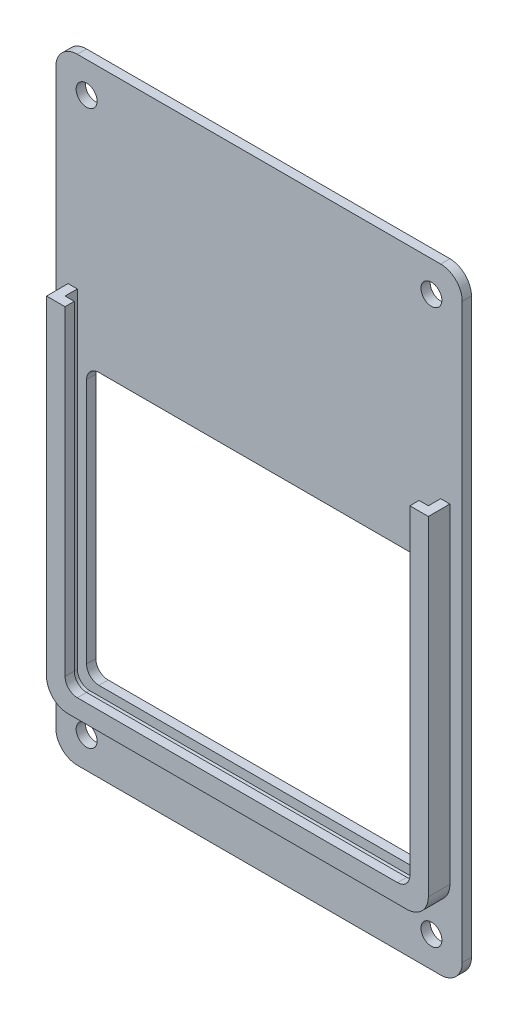
from build123d import *

# Parameters (mm, degrees)
SKETCH_1_W          = 66
SKETCH_1_H          = 100
EXTRUDE_1_DEPTH     = 1.5
FILLET_1_R          = 3.5
SKETCH_2_W          = 56
SKETCH_2_H          = 44
CUT_EXTRUDE_1_DEPTH = 1.5
FILLET_2_R          = 2
EXTRUDE_2_DEPTH     = 2
FILLET_3_R          = 2
EXTRUDE_START       = 1.5
EXTRUDE_3_DEPTH     = 1.5
FILLET_4_R          = 2
FILLET_5_R          = 3.5
SKETCH_5_W          = 48
SKETCH_5_H          = 10
EXTRUDE_4_DEPTH     = 1.5
FILLET_6_R          = 2
HOLE_WIZARD_M31_D   = 3.4
CUT_EXTRUDE_2_DEPTH = 1.5
CUT_EXTRUDE_3_DEPTH = 1.5


with BuildPart() as part:
    # Эскиз1 → Бобышка-Вытянуть1 (new body)
    with BuildSketch(Plane.XY):
        Rectangle(SKETCH_1_W, SKETCH_1_H)
    extrude(amount=EXTRUDE_1_DEPTH)

    # Скругление1
    fillet_1_edges = [part.edges().sort_by_distance(p)[0] for p in [
        (-33, -50, 0.75),
        (-33, 50, 0.75),
        (33, 50, 0.75),
        (33, -50, 0.75),
    ]]
    fillet(fillet_1_edges, radius=FILLET_1_R)

    # Эскиз2 → Вырез-Вытянуть1 (cut)
    with BuildSketch(Plane.XY.offset(1.5)):
        with Locations((0, -15)):
            Rectangle(SKETCH_2_W, SKETCH_2_H)
    extrude(amount=-CUT_EXTRUDE_1_DEPTH, mode=Mode.SUBTRACT)

    # Скругление2
    fillet_2_edges = [part.edges().sort_by_distance(p)[0] for p in [
        (28, 7, 0.75),
        (28, -37, 0.75),
        (-28, -37, 0.75),
        (-28, 7, 0.75),
    ]]
    fillet(fillet_2_edges, radius=FILLET_2_R)

    # Эскиз3 → Бобышка-Вытянуть2 (add)
    with BuildSketch(Plane.XY.offset(1.5)):
        Polygon((29.5, -38.5), (-29.5, -38.5), (-29.5, 17), (-31, 17), (-31, -40), (31, -40), (31, 17), (29.5, 17), align=None)
    extrude(amount=EXTRUDE_2_DEPTH)

    # Скругление3
    fillet_3_edges = [part.edges().sort_by_distance(p)[0] for p in [
        (29.5, -38.5, 2.5),
        (-29.5, -38.5, 2.5),
    ]]
    fillet(fillet_3_edges, radius=FILLET_3_R)

    # Эскиз4 → Бобышка-Вытянуть3 (add)
    with BuildSketch(Plane.XY.offset(3.5).offset(EXTRUDE_START)):
        with BuildLine():
            Line((-31, -40), (31, -40))
            Line((31, -40), (31, 17))
            Line((31, 17), (29.5, 17))
            Line((29.5, 17), (29.5, -36.5))
            ThreePointArc((29.5, -36.5), (28.914213562, -37.914213562), (27.5, -38.5))
            Line((27.5, -38.5), (-27.5, -38.5))
            ThreePointArc((-27.5, -38.5), (-28.914213562, -37.914213562), (-29.5, -36.5))
            Line((-29.5, -36.5), (-29.5, 17))
            Line((-29.5, 17), (-31, 17))
            Line((-31, 17), (-31, -40))
        make_face()
        with BuildLine():
            Line((-28, 17), (-29.5, 17))
            Line((-29.5, 17), (-29.5, -36.5))
            ThreePointArc((-29.5, -36.5), (-28.914213562, -37.914213562), (-27.5, -38.5))
            Line((-27.5, -38.5), (27.5, -38.5))
            ThreePointArc((27.5, -38.5), (28.914213562, -37.914213562), (29.5, -36.5))
            Line((29.5, -36.5), (29.5, 17))
            Line((29.5, 17), (28, 17))
            Line((28, 17), (28, -37))
            Line((28, -37), (-28, -37))
            Line((-28, -37), (-28, 17))
        make_face()
    extrude(amount=-EXTRUDE_3_DEPTH)

    # Скругление4
    fillet_4_edges = [part.edges().sort_by_distance(p)[0] for p in [
        (28, -37, 4.25),
        (-28, -37, 4.25),
    ]]
    fillet(fillet_4_edges, radius=FILLET_4_R)

    # Скругление5
    fillet_5_edges = [part.edges().sort_by_distance(p)[0] for p in [
        (31, -40, 3.25),
        (-31, -40, 3.25),
    ]]
    fillet(fillet_5_edges, radius=FILLET_5_R)

    # Эскиз5 → Бобышка-Вытянуть4 (add)
    with BuildSketch(Plane(origin=(0, 0, 0), x_dir=(-1, 0, 0), z_dir=(0, 0, -1))):
        Polygon((24, 48.5), (-24, 48.5), (-24, 41), (-31.5, 41), (-31.5, 8), (31.5, 8), (31.5, 41), (24, 41), align=None)
        with Locations((0, -43.5)):
            Rectangle(SKETCH_5_W, SKETCH_5_H)
    extrude(amount=EXTRUDE_4_DEPTH)

    # Скругление6
    fillet_6_edges = [part.edges().sort_by_distance(p)[0] for p in [
        (-24, 48.5, -0.75),
        (24, 48.5, -0.75),
        (24, 41, -0.75),
        (31.5, 41, -0.75),
        (31.5, 8, -0.75),
        (-31.5, 8, -0.75),
        (-31.5, 41, -0.75),
        (-24, 41, -0.75),
        (-24, -48.5, -0.75),
        (-24, -38.5, -0.75),
        (24, -38.5, -0.75),
        (24, -48.5, -0.75),
    ]]
    fillet(fillet_6_edges, radius=FILLET_6_R)

    # Отверстие с зазором M31 (through all)
    with Locations(Plane.XY.offset(1.5)):
        with Locations((-28, 45), (28, 45), (28, -45), (-28, -45)):
            Hole(HOLE_WIZARD_M31_D / 2)

    # Sketch 1 2 → Вырез-Вытянуть2 (cut)
    with BuildSketch(Plane(origin=(-22.5, 43, -1.5), x_dir=(0.969195618248602, -0.24629221174797694, 0), z_dir=(0, 0, -1))):
        with BuildLine():
            Line((0, 0), (-0.862022741, -3.392184664))
            add(Edge.make_bspline(
                [(-0.862022741, -3.392184664), (-0.863457613, -3.397831093), (-0.864892485, -3.403477523), (-0.866283544, -3.409134242), (-0.870193841, -3.426166131), (-0.872921182, -3.443475822), (-0.87429772, -3.455099278), (-0.876845006, -3.484267559), (-0.877682577, -3.513461156), (-0.877506842, -3.530961817), (-0.875673257, -3.565882924), (-0.870624324, -3.600545153), (-0.867321375, -3.617762152), (-0.859209221, -3.651869127), (-0.848185975, -3.685124473), (-0.841958, -3.701499226), (-0.828092189, -3.733662861), (-0.811452342, -3.764494704), (-0.802462818, -3.779537639), (-0.783192383, -3.808797464), (-0.76143481, -3.836245043), (-0.749964121, -3.84948679), (-0.725898702, -3.874948234), (-0.699704731, -3.898249651), (-0.686106911, -3.909314514), (-0.65808457, -3.930097534), (-0.628323297, -3.948192056), (-0.613121943, -3.95657929), (-0.587278851, -3.969569135), (-0.560664248, -3.981070005), (-0.54991601, -3.985331953), (-0.533659435, -3.991075379), (-0.517093145, -3.995685826), (-0.511593299, -3.997127599), (-0.506082169, -3.998528089), (-0.500571038, -3.999928579)],
                knots=[0, 0, 0, 0, 0, 0, 0.037135921, 0.037135921, 0.037135921, 0.111407738, 0.111407738, 0.111407738, 0.222815464, 0.222815464, 0.222815464, 0.334223191, 0.334223191, 0.334223191, 0.445630917, 0.445630917, 0.445630917, 0.557038643, 0.557038643, 0.557038643, 0.668446369, 0.668446369, 0.668446369, 0.779854095, 0.779854095, 0.779854095, 0.890371976, 0.890371976, 0.890371976, 0.963753949, 0.963753949, 0.963753949, 1, 1, 1, 1, 1, 1], degree=5))
            Line((-0.500571038, -3.999928579), (42.144036165, -14.836785896))
            add(Edge.make_bspline(
                [(42.144036165, -14.836785896), (42.149682595, -14.838220768), (42.155329024, -14.83965564), (42.160985743, -14.841046699), (42.178017632, -14.844956996), (42.195327323, -14.847684337), (42.206950779, -14.849060874), (42.23611906, -14.851608161), (42.265312657, -14.852445732), (42.282813319, -14.852269997), (42.317734425, -14.850436412), (42.352396654, -14.845387479), (42.369613653, -14.84208453), (42.403720629, -14.833972376), (42.436975975, -14.822949129), (42.453350727, -14.816721154), (42.485514362, -14.802855343), (42.516346205, -14.786215497), (42.53138914, -14.777225972), (42.560648965, -14.757955538), (42.588096545, -14.736197965), (42.601338291, -14.724727276), (42.626799735, -14.700661857), (42.650101153, -14.674467885), (42.661166015, -14.660870065), (42.681949035, -14.632847725), (42.700043558, -14.603086451), (42.708430792, -14.587885098), (42.721420637, -14.562042006), (42.732921506, -14.535427403), (42.737183454, -14.524679164), (42.742926881, -14.50842259), (42.747537327, -14.491856299), (42.7489791, -14.486356454), (42.75037959, -14.480845323), (42.75178008, -14.475334193)],
                knots=[0, 0, 0, 0, 0, 0, 0.037135921, 0.037135921, 0.037135921, 0.111407738, 0.111407738, 0.111407738, 0.222815464, 0.222815464, 0.222815464, 0.334223191, 0.334223191, 0.334223191, 0.445630917, 0.445630917, 0.445630917, 0.557038643, 0.557038643, 0.557038643, 0.668446369, 0.668446369, 0.668446369, 0.779854095, 0.779854095, 0.779854095, 0.890371976, 0.890371976, 0.890371976, 0.963753949, 0.963753949, 0.963753949, 1, 1, 1, 1, 1, 1], degree=5))
            Line((42.75178008, -14.475334193), (43.613802821, -11.083149529))
            add(Edge.make_bspline(
                [(43.613802821, -11.083149529), (43.623846925, -11.043624522), (43.633891029, -11.004099514), (43.644239002, -10.964657641), (43.677106133, -10.846830819), (43.718177724, -10.731248595), (43.748555104, -10.655155268), (43.830364086, -10.467235402), (43.922773731, -10.284873474), (43.982339652, -10.177818354), (44.110319556, -9.969154549), (44.257211167, -9.772828329), (44.335063874, -9.677968706), (44.498941039, -9.495294617), (44.677877604, -9.327587204), (44.770906765, -9.247683112), (44.963678906, -9.096190047), (45.169062799, -8.962159001), (45.274626829, -8.899675347), (45.490937351, -8.784104506), (45.716489377, -8.687992056), (45.831295114, -8.644878827), (46.064404733, -8.568695156), (46.303388035, -8.512910654), (46.424002373, -8.490295529), (46.665815372, -8.456111266), (46.909339508, -8.444274609), (47.030868499, -8.443487745), (47.233233643, -8.449954674), (47.435368198, -8.468158228), (47.515720951, -8.47786327), (47.634905086, -8.496864254), (47.75220793, -8.523868962), (47.790854396, -8.533380749), (47.829432311, -8.543184177), (47.868010226, -8.552987606)],
                knots=[0, 0, 0, 0, 0, 0, 0.037135909, 0.037135909, 0.037135909, 0.111407726, 0.111407726, 0.111407726, 0.222815452, 0.222815452, 0.222815452, 0.334223178, 0.334223178, 0.334223178, 0.445630904, 0.445630904, 0.445630904, 0.55703863, 0.55703863, 0.55703863, 0.668446357, 0.668446357, 0.668446357, 0.779854083, 0.779854083, 0.779854083, 0.890371964, 0.890371964, 0.890371964, 0.963753936, 0.963753936, 0.963753936, 1, 1, 1, 1, 1, 1], degree=5))
            Line((47.868010226, -8.552987606), (51.26019489, -9.415010347))
            add(Edge.make_bspline(
                [(51.26019489, -9.415010347), (51.26584132, -9.416445219), (51.271487749, -9.417880091), (51.277144468, -9.41927115), (51.294176357, -9.423181447), (51.311486048, -9.425908788), (51.323109504, -9.427285325), (51.352277785, -9.429832612), (51.381471382, -9.430670183), (51.398972044, -9.430494448), (51.43389315, -9.428660863), (51.468555379, -9.42361193), (51.485772378, -9.420308981), (51.519879354, -9.412196827), (51.5531347, -9.401173581), (51.569509452, -9.394945606), (51.601673087, -9.381079795), (51.63250493, -9.364439948), (51.647547865, -9.355450423), (51.67680769, -9.336179989), (51.704255269, -9.314422416), (51.717497016, -9.302951727), (51.74295846, -9.278886308), (51.766259878, -9.252692337), (51.77732474, -9.239094517), (51.79810776, -9.211072176), (51.816202283, -9.181310903), (51.824589517, -9.166109549), (51.837579362, -9.140266457), (51.849080231, -9.113651854), (51.853342179, -9.102903616), (51.859085606, -9.086647041), (51.863696052, -9.07008075), (51.865137825, -9.064580905), (51.866538315, -9.059069774), (51.867938805, -9.053558644)],
                knots=[0, 0, 0, 0, 0, 0, 0.037135921, 0.037135921, 0.037135921, 0.111407738, 0.111407738, 0.111407738, 0.222815464, 0.222815464, 0.222815464, 0.334223191, 0.334223191, 0.334223191, 0.445630917, 0.445630917, 0.445630917, 0.557038643, 0.557038643, 0.557038643, 0.668446369, 0.668446369, 0.668446369, 0.779854095, 0.779854095, 0.779854095, 0.890371976, 0.890371976, 0.890371976, 0.963753949, 0.963753949, 0.963753949, 1, 1, 1, 1, 1, 1], degree=5))
            Line((51.867938805, -9.053558644), (59.010412946, 19.053114285))
            add(Edge.make_bspline(
                [(59.010412946, 19.053114285), (59.011847818, 19.058760715), (59.01328269, 19.064407145), (59.014673748, 19.070063863), (59.018584046, 19.087095752), (59.021311387, 19.104405444), (59.022687924, 19.1160289), (59.025235211, 19.14519718), (59.026072782, 19.174390778), (59.025897047, 19.191891439), (59.024063462, 19.226812545), (59.019014529, 19.261474774), (59.01571158, 19.278691773), (59.007599426, 19.312798749), (58.996576179, 19.346054095), (58.990348204, 19.362428847), (58.976482393, 19.394592482), (58.959842547, 19.425424325), (58.950853022, 19.440467261), (58.931582588, 19.469727085), (58.909825015, 19.497174665), (58.898354326, 19.510416412), (58.874288907, 19.535877856), (58.848094935, 19.559179273), (58.834497115, 19.570244135), (58.806474775, 19.591027156), (58.776713501, 19.609121678), (58.761512148, 19.617508912), (58.735669056, 19.630498757), (58.709054453, 19.641999627), (58.698306214, 19.646261574), (58.68204964, 19.652005001), (58.665483349, 19.656615447), (58.659983504, 19.658057221), (58.654472373, 19.659457711), (58.648961242, 19.6608582)],
                knots=[0, 0, 0, 0, 0, 0, 0.037135921, 0.037135921, 0.037135921, 0.111407738, 0.111407738, 0.111407738, 0.222815464, 0.222815464, 0.222815464, 0.334223191, 0.334223191, 0.334223191, 0.445630917, 0.445630917, 0.445630917, 0.557038643, 0.557038643, 0.557038643, 0.668446369, 0.668446369, 0.668446369, 0.779854095, 0.779854095, 0.779854095, 0.890371976, 0.890371976, 0.890371976, 0.963753949, 0.963753949, 0.963753949, 1, 1, 1, 1, 1, 1], degree=5))
            Line((58.648961242, 19.6608582), (1.466419766, 34.192098694))
            add(Edge.make_bspline(
                [(1.466419766, 34.192098694), (1.460773336, 34.193533566), (1.455126907, 34.194968438), (1.449470188, 34.196359496), (1.432438299, 34.200269794), (1.415128608, 34.202997135), (1.403505152, 34.204373672), (1.374336871, 34.206920959), (1.345143274, 34.20775853), (1.327642612, 34.207582795), (1.292721506, 34.20574921), (1.258059277, 34.200700277), (1.240842278, 34.197397327), (1.206735302, 34.189285174), (1.173479956, 34.178261927), (1.157105204, 34.172033952), (1.124941569, 34.158168141), (1.094109726, 34.141528294), (1.079066791, 34.13253877), (1.049806966, 34.113268336), (1.022359386, 34.091510763), (1.009117639, 34.080040074), (0.983656195, 34.055974655), (0.960354778, 34.029780683), (0.949289916, 34.016182863), (0.928506896, 33.988160522), (0.910412373, 33.958399249), (0.902025139, 33.943197896), (0.889035294, 33.917354804), (0.877534424, 33.890740201), (0.873272477, 33.879991962), (0.86752905, 33.863735387), (0.862918604, 33.847169097), (0.86147683, 33.841669252), (0.860076341, 33.836158121), (0.858675851, 33.83064699)],
                knots=[0, 0, 0, 0, 0, 0, 0.037135921, 0.037135921, 0.037135921, 0.111407738, 0.111407738, 0.111407738, 0.222815464, 0.222815464, 0.222815464, 0.334223191, 0.334223191, 0.334223191, 0.445630917, 0.445630917, 0.445630917, 0.557038643, 0.557038643, 0.557038643, 0.668446369, 0.668446369, 0.668446369, 0.779854095, 0.779854095, 0.779854095, 0.890371976, 0.890371976, 0.890371976, 0.963753949, 0.963753949, 0.963753949, 1, 1, 1, 1, 1, 1], degree=5))
            Line((0.858675851, 33.83064699), (-6.28379829, 5.723974061))
            add(Edge.make_bspline(
                [(-6.28379829, 5.723974061), (-6.285233162, 5.718327632), (-6.286668034, 5.712681202), (-6.288059093, 5.707024483), (-6.29196939, 5.689992594), (-6.294696731, 5.672682903), (-6.296073268, 5.661059447), (-6.298620555, 5.631891166), (-6.299458126, 5.602697569), (-6.299282391, 5.585196908), (-6.297448806, 5.550275801), (-6.292399873, 5.515613572), (-6.289096924, 5.498396573), (-6.28098477, 5.464289598), (-6.269961523, 5.431034252), (-6.263733548, 5.414659499), (-6.249867738, 5.382495864), (-6.233227891, 5.351664021), (-6.224238366, 5.336621086), (-6.204967932, 5.307361261), (-6.183210359, 5.279913682), (-6.17173967, 5.266671935), (-6.147674251, 5.241210491), (-6.121480279, 5.217909074), (-6.107882459, 5.206844211), (-6.079860119, 5.186061191), (-6.050098845, 5.167966669), (-6.034897492, 5.159579435), (-6.0090544, 5.14658959), (-5.982439797, 5.13508872), (-5.971691558, 5.130826772), (-5.955434984, 5.125083346), (-5.938868693, 5.120472899), (-5.933368848, 5.119031126), (-5.927857717, 5.117630636), (-5.922346587, 5.116230146)],
                knots=[0, 0, 0, 0, 0, 0, 0.037135921, 0.037135921, 0.037135921, 0.111407738, 0.111407738, 0.111407738, 0.222815464, 0.222815464, 0.222815464, 0.334223191, 0.334223191, 0.334223191, 0.445630917, 0.445630917, 0.445630917, 0.557038643, 0.557038643, 0.557038643, 0.668446369, 0.668446369, 0.668446369, 0.779854095, 0.779854095, 0.779854095, 0.890371976, 0.890371976, 0.890371976, 0.963753949, 0.963753949, 0.963753949, 1, 1, 1, 1, 1, 1], degree=5))
            Line((-5.922346587, 5.116230146), (-2.530161923, 4.254207405))
            add(Edge.make_bspline(
                [(-2.530161923, 4.254207405), (-2.490636916, 4.244163301), (-2.451111909, 4.234119197), (-2.411670035, 4.223771225), (-2.293843213, 4.190904093), (-2.178260989, 4.149832502), (-2.102167662, 4.119455122), (-1.914247796, 4.03764614), (-1.731885868, 3.945236495), (-1.624830748, 3.885670574), (-1.416166943, 3.75769067), (-1.219840723, 3.610799059), (-1.1249811, 3.532946352), (-0.942307011, 3.369069187), (-0.774599598, 3.190132622), (-0.694695506, 3.097103461), (-0.543202442, 2.904331321), (-0.409171395, 2.698947428), (-0.346687741, 2.593383397), (-0.2311169, 2.377072875), (-0.13500445, 2.151520849), (-0.091891221, 2.036715112), (-0.01570755, 1.803605493), (0.040076952, 1.564622192), (0.062692077, 1.444007853), (0.09687634, 1.202194854), (0.108712997, 0.958670718), (0.109499861, 0.837141727), (0.103032931, 0.634776583), (0.084829378, 0.432642028), (0.075124336, 0.352289275), (0.056123352, 0.23310514), (0.029118644, 0.115802296), (0.019606857, 0.07715583), (0.009803429, 0.038577915), (0, 0)],
                knots=[0, 0, 0, 0, 0, 0, 0.037135909, 0.037135909, 0.037135909, 0.111407726, 0.111407726, 0.111407726, 0.222815452, 0.222815452, 0.222815452, 0.334223178, 0.334223178, 0.334223178, 0.445630904, 0.445630904, 0.445630904, 0.55703863, 0.55703863, 0.55703863, 0.668446357, 0.668446357, 0.668446357, 0.779854083, 0.779854083, 0.779854083, 0.890371964, 0.890371964, 0.890371964, 0.963753936, 0.963753936, 0.963753936, 1, 1, 1, 1, 1, 1], degree=5))
        make_face()
    extrude(amount=-CUT_EXTRUDE_2_DEPTH, mode=Mode.SUBTRACT)

    # Sketch 2 2 → Вырез-Вытянуть3 (cut)
    with BuildSketch(Plane(origin=(22.5, -40.5, -1.5), x_dir=(-0.9727315202591494, 0.23193401970026753, 0), z_dir=(0, 0, 1))):
        with BuildLine():
            Line((0, 0), (-1.391604118, 5.836389122))
            add(Edge.make_bspline(
                [(-1.391604118, 5.836389122), (-1.392955341, 5.842056151), (-1.394306564, 5.84772318), (-1.395613826, 5.85339985), (-1.399271849, 5.870487698), (-1.401742938, 5.887835825), (-1.402947451, 5.899478364), (-1.405063155, 5.928681122), (-1.405468956, 5.957883913), (-1.405034462, 5.975380062), (-1.402684707, 6.010270238), (-1.397123784, 6.04485402), (-1.393566612, 6.062020297), (-1.384951014, 6.096003591), (-1.373437233, 6.129092303), (-1.36696781, 6.145373173), (-1.352627919, 6.177328262), (-1.335533988, 6.207910684), (-1.32632301, 6.222819049), (-1.306622025, 6.251790727), (-1.284460969, 6.278913582), (-1.272795732, 6.291984267), (-1.248356452, 6.317087078), (-1.221820792, 6.339998623), (-1.208060845, 6.350861208), (-1.179734254, 6.371227596), (-1.149708675, 6.388880068), (-1.134384964, 6.397041606), (-1.108352619, 6.409647895), (-1.081570866, 6.420753964), (-1.070760782, 6.424856514), (-1.054421058, 6.43035893), (-1.037788405, 6.434723911), (-1.032267842, 6.436084202), (-1.026736605, 6.437403047), (-1.021205368, 6.438721892)],
                knots=[0, 0, 0, 0, 0, 0, 0.037135921, 0.037135921, 0.037135921, 0.111407738, 0.111407738, 0.111407738, 0.222815464, 0.222815464, 0.222815464, 0.334223191, 0.334223191, 0.334223191, 0.445630917, 0.445630917, 0.445630917, 0.557038643, 0.557038643, 0.557038643, 0.668446369, 0.668446369, 0.668446369, 0.779854095, 0.779854095, 0.779854095, 0.890371976, 0.890371976, 0.890371976, 0.963753949, 0.963753949, 0.963753949, 1, 1, 1, 1, 1, 1], degree=5))
            Line((-1.021205368, 6.438721892), (41.778981523, 16.643818758))
            add(Edge.make_bspline(
                [(41.778981523, 16.643818758), (41.784648553, 16.645169981), (41.790315582, 16.646521204), (41.795992252, 16.647828466), (41.813080099, 16.651486489), (41.830428227, 16.653957578), (41.842070766, 16.655162091), (41.871273524, 16.657277795), (41.900476315, 16.657683596), (41.917972464, 16.657249102), (41.95286264, 16.654899347), (41.987446422, 16.649338424), (42.004612699, 16.645781252), (42.038595993, 16.637165654), (42.071684705, 16.625651873), (42.087965575, 16.61918245), (42.119920663, 16.604842559), (42.150503086, 16.587748628), (42.165411451, 16.57853765), (42.194383129, 16.558836665), (42.221505984, 16.53667561), (42.234576669, 16.525010372), (42.259679479, 16.500571092), (42.282591025, 16.474035432), (42.29345361, 16.460275485), (42.313819998, 16.431948894), (42.33147247, 16.401923315), (42.339634008, 16.386599604), (42.352240297, 16.36056726), (42.363346366, 16.333785506), (42.367448915, 16.322975422), (42.372951332, 16.306635698), (42.377316313, 16.290003045), (42.378676604, 16.284482482), (42.379995449, 16.278951245), (42.381314293, 16.273420008)],
                knots=[0, 0, 0, 0, 0, 0, 0.037135921, 0.037135921, 0.037135921, 0.111407738, 0.111407738, 0.111407738, 0.222815464, 0.222815464, 0.222815464, 0.334223191, 0.334223191, 0.334223191, 0.445630917, 0.445630917, 0.445630917, 0.557038643, 0.557038643, 0.557038643, 0.668446369, 0.668446369, 0.668446369, 0.779854095, 0.779854095, 0.779854095, 0.890371976, 0.890371976, 0.890371976, 0.963753949, 0.963753949, 0.963753949, 1, 1, 1, 1, 1, 1], degree=5))
            Line((42.381314293, 16.273420008), (43.772918412, 10.437030887))
            add(Edge.make_bspline(
                [(43.772918412, 10.437030887), (43.774269634, 10.431363857), (43.775620857, 10.425696828), (43.776928119, 10.420020158), (43.780586142, 10.402932311), (43.783057231, 10.385584183), (43.784261745, 10.373941644), (43.786377449, 10.344738886), (43.786783249, 10.315536095), (43.786348755, 10.298039946), (43.783999001, 10.26314977), (43.778438077, 10.228565988), (43.774880906, 10.211399711), (43.766265307, 10.177416417), (43.754751527, 10.144327705), (43.748282103, 10.128046835), (43.733942212, 10.096091747), (43.716848281, 10.065509324), (43.707637304, 10.050600959), (43.687936318, 10.021629281), (43.665775263, 9.994506426), (43.654110025, 9.981435741), (43.629670745, 9.956332931), (43.603135085, 9.933421385), (43.589375138, 9.9225588), (43.561048548, 9.902192412), (43.531022969, 9.88453994), (43.515699257, 9.876378402), (43.489666913, 9.863772113), (43.462885159, 9.852666044), (43.452075075, 9.848563495), (43.435735351, 9.843061078), (43.419102698, 9.838696097), (43.413582135, 9.837335806), (43.408050898, 9.836016961), (43.402519661, 9.834698117)],
                knots=[0, 0, 0, 0, 0, 0, 0.037135921, 0.037135921, 0.037135921, 0.111407738, 0.111407738, 0.111407738, 0.222815464, 0.222815464, 0.222815464, 0.334223191, 0.334223191, 0.334223191, 0.445630917, 0.445630917, 0.445630917, 0.557038643, 0.557038643, 0.557038643, 0.668446369, 0.668446369, 0.668446369, 0.779854095, 0.779854095, 0.779854095, 0.890371976, 0.890371976, 0.890371976, 0.963753949, 0.963753949, 0.963753949, 1, 1, 1, 1, 1, 1], degree=5))
            Line((43.402519661, 9.834698117), (0.60233277, -0.37039875))
            add(Edge.make_bspline(
                [(0.60233277, -0.37039875), (0.596665741, -0.371749973), (0.590998711, -0.373101196), (0.585322042, -0.374408458), (0.568234194, -0.378066481), (0.550886067, -0.38053757), (0.539243527, -0.381742083), (0.510040769, -0.383857787), (0.480837979, -0.384263588), (0.463341829, -0.383829094), (0.428451654, -0.381479339), (0.393867872, -0.375918416), (0.376701595, -0.372361244), (0.342718301, -0.363745646), (0.309629589, -0.352231865), (0.293348718, -0.345762442), (0.26139363, -0.331422551), (0.230811207, -0.31432862), (0.215902842, -0.305117642), (0.186931164, -0.285416657), (0.15980831, -0.263255601), (0.146737625, -0.251590364), (0.121634814, -0.227151084), (0.098723268, -0.200615424), (0.087860684, -0.186855477), (0.067494295, -0.158528886), (0.049841824, -0.128503307), (0.041680286, -0.113179596), (0.029073996, -0.087147252), (0.017967928, -0.060365498), (0.013865378, -0.049555414), (0.008362961, -0.03321569), (0.003997981, -0.016583037), (0.00263769, -0.011062474), (0.001318845, -0.005531237), (0, 0)],
                knots=[0, 0, 0, 0, 0, 0, 0.037135921, 0.037135921, 0.037135921, 0.111407738, 0.111407738, 0.111407738, 0.222815464, 0.222815464, 0.222815464, 0.334223191, 0.334223191, 0.334223191, 0.445630917, 0.445630917, 0.445630917, 0.557038643, 0.557038643, 0.557038643, 0.668446369, 0.668446369, 0.668446369, 0.779854095, 0.779854095, 0.779854095, 0.890371976, 0.890371976, 0.890371976, 0.963753949, 0.963753949, 0.963753949, 1, 1, 1, 1, 1, 1], degree=5))
        make_face()
    extrude(amount=CUT_EXTRUDE_3_DEPTH, mode=Mode.SUBTRACT)


solid = part.part
